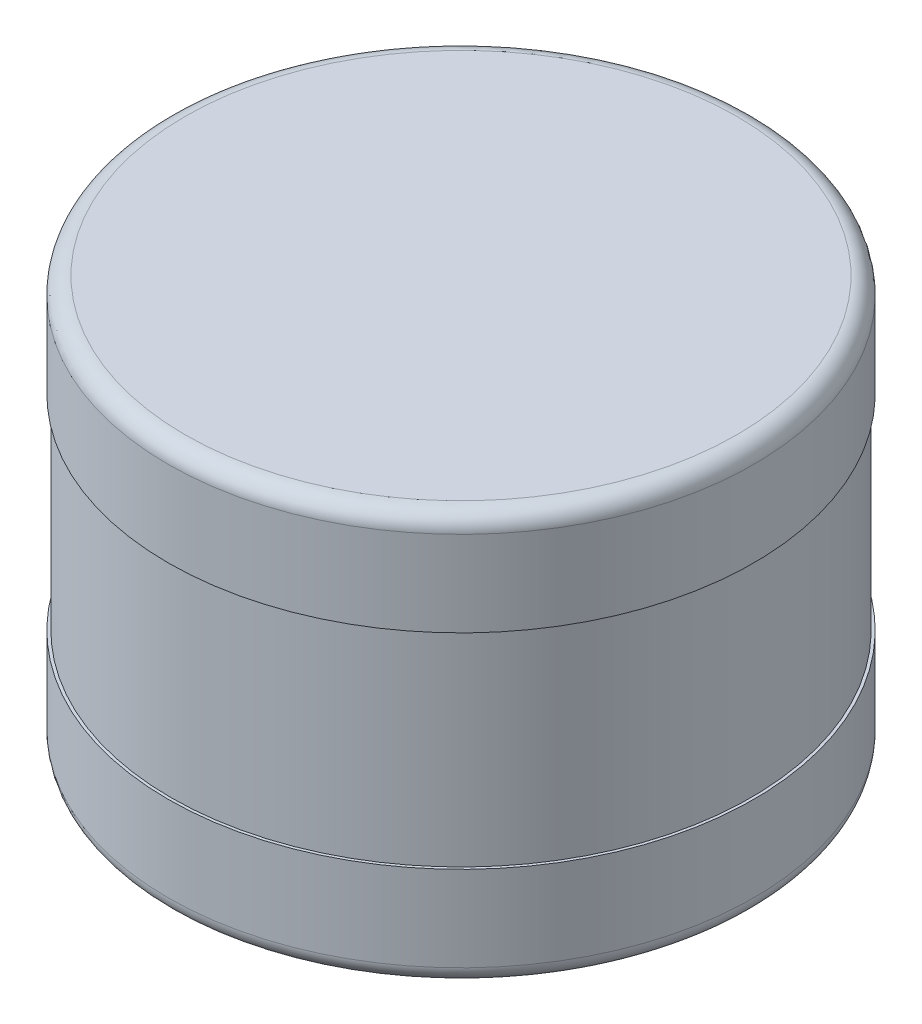
from build123d import *

# Parameters (mm, degrees)
SKETCH_1_R      = 51.5
EXTRUDE_1_DEPTH = 72
FILLET_1_R      = 3


with BuildPart() as part:
    # 草图1 → 凸台-拉伸1 (new body)
    with BuildSketch(Plane(origin=(0, 0, 0), x_dir=(1, 0, 0), z_dir=(0, 1, 0))):
        with Locations(Location((0, 0, 0), (0, 0, 270))):
            Circle(SKETCH_1_R)
    extrude(amount=EXTRUDE_1_DEPTH)

    # 圆角1
    fillet_1_edges = [part.edges().sort_by_distance(p)[0] for p in [
        (0, 0, -51.5),
        (0, 72, -51.5),
    ]]
    fillet(fillet_1_edges, radius=FILLET_1_R)

    # 草图2 → 切除-旋转1 (revolve, cut)
    with BuildSketch(Plane.XY, mode=Mode.PRIVATE) as cut_revolve_1_sk:
        Polygon((51.5, 36), (51.5, 54), (51, 54), (51, 18), (51.5, 18), align=None)
    revolve(cut_revolve_1_sk.sketch.rotate(Axis((0, 0, 0), (0, 1, 0)), 90), axis=Axis((0, 0, 0), (0, 1, 0)), mode=Mode.SUBTRACT)


solid = part.part
